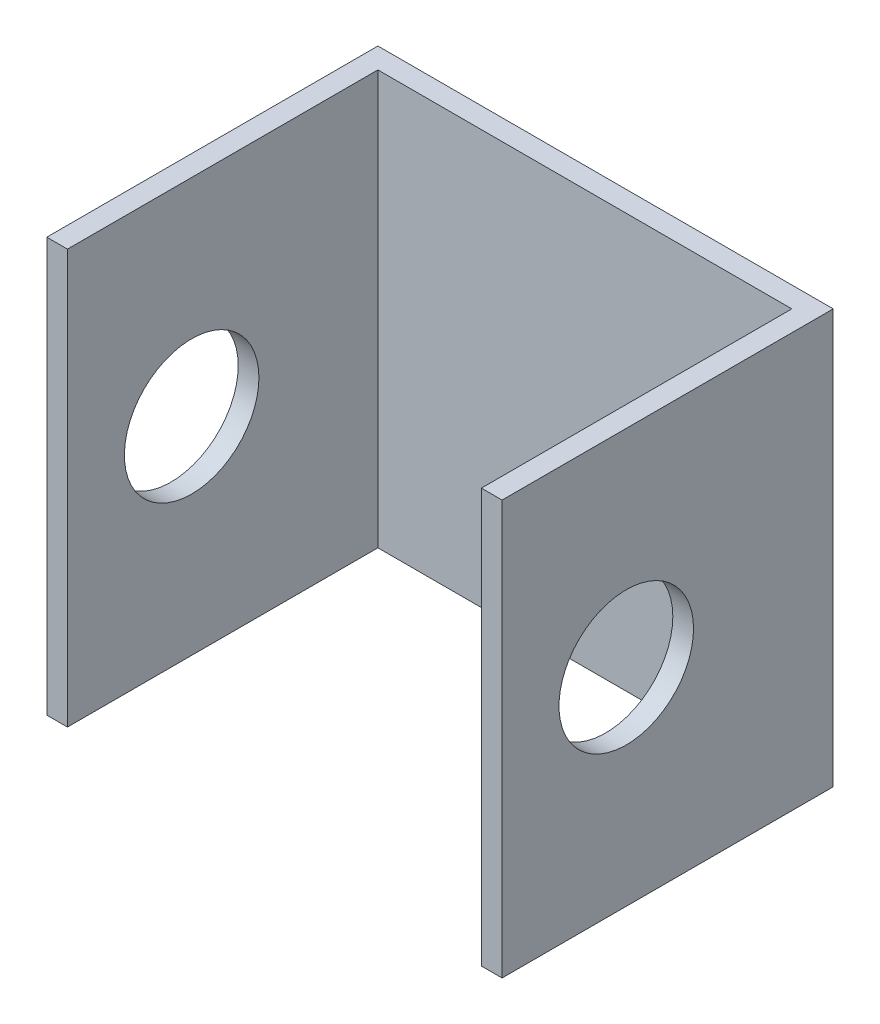
from build123d import *

# Parameters (mm, degrees)
SKETCH1_W           = 22
SKETCH1_H           = 20
BOSS_EXTRUDE1_DEPTH = 1
SKETCH2_W           = 1
SKETCH2_H           = 20
BOSS_EXTRUDE2_DEPTH = 15
SKETCH3_R           = 3.25
CUT_EXTRUDE1_DEPTH  = 29.982753492


with BuildPart() as part:
    # Sketch1 → Boss-Extrude1 (new body)
    with BuildSketch(Plane.XY):
        Rectangle(SKETCH1_W, SKETCH1_H)
    extrude(amount=BOSS_EXTRUDE1_DEPTH)

    # Sketch2 → Boss-Extrude2 (add)
    with BuildSketch(Plane.XY.offset(1)):
        with Locations((-10.5, 0)):
            Rectangle(SKETCH2_W, SKETCH2_H)
        with Locations((10.5, 0)):
            Rectangle(SKETCH2_W, SKETCH2_H)
    extrude(amount=BOSS_EXTRUDE2_DEPTH)

    # Sketch3 → Cut-Extrude1 (cut, through all)
    with BuildSketch(Plane(origin=(11, 0, 0), x_dir=(0, 0, -1), z_dir=(1, 0, 0))):
        with Locations((-10, 0)):
            Circle(SKETCH3_R)
    extrude(amount=-CUT_EXTRUDE1_DEPTH, mode=Mode.SUBTRACT)


solid = part.part
